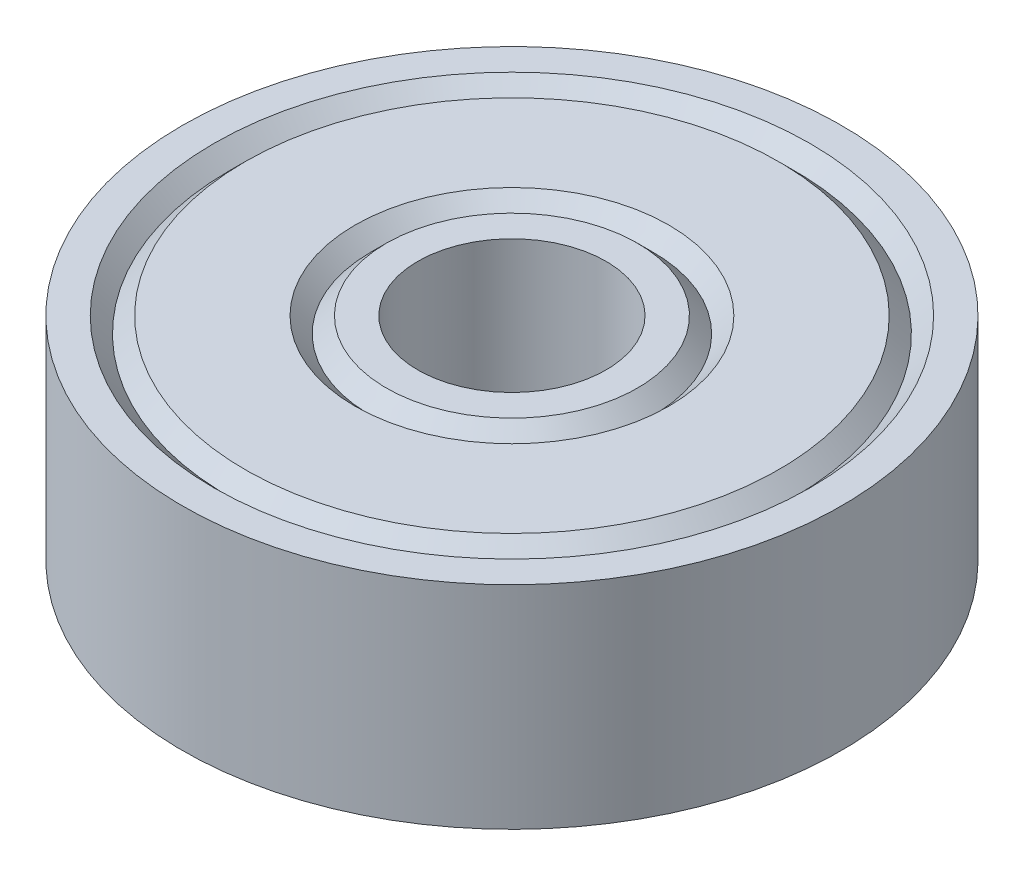
from build123d import *


with BuildPart() as part:
    # Sketch1 → Revolve1 (revolve)
    with BuildSketch(Plane.XY):
        Polygon((-4, 4.5), (-5.333333333, 4.5), (-6, 3.833333333), (-6.666666667, 4.5), (-11.333333333, 4.5), (-12, 3.833333333), (-12.666666667, 4.5), (-14, 4.5), (-14, -4.5), (-12.666666667, -4.5), (-12, -3.833333333), (-11.333333333, -4.5), (-6.666666667, -4.5), (-6, -3.833333333), (-5.333333333, -4.5), (-4, -4.5), align=None)
    revolve(axis=Axis((0, 4.5, 0), (0, -1, 0)))


solid = part.part
